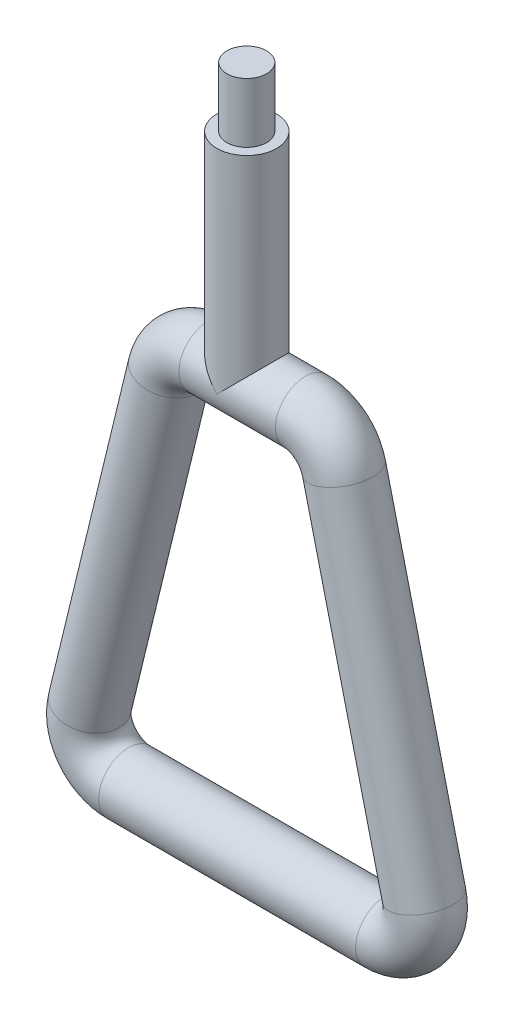
from build123d import *

# Parameters (mm, degrees)
SWEEP1_PROFILE_R         = 7.5
BOSS_EXTRUDE1_REACH      = 188.649
BOSS_EXTRUDE1_END_RADIUS = 7.5
SKETCH10_R               = 7.5
SKETCH11_R               = 7.5
SKETCH11_R_2             = 5
CUT_EXTRUDE1_DEPTH       = 15


with BuildPart() as part:
    # Sweep1: sweep along a path in Sketch1
    with BuildLine(Plane.XY) as sweep1_path:
        Line((-9.568747019, 51.5), (14.70492956, 51.5))
        ThreePointArc((14.70492956, 51.5), (20.88607003, 49.360884333), (24.422775616, 43.858700499))
        Line((24.422775616, 43.858700499), (44.568406684, -39.141299501))
        ThreePointArc((44.568406684, -39.141299501), (42.711444961, -47.68114047), (34.850560628, -51.5))
        Line((34.850560628, -51.5), (-29.714378087, -51.5))
        ThreePointArc((-29.714378087, -51.5), (-37.57526242, -47.68114047), (-39.432224142, -39.141299501))
        Line((-39.432224142, -39.141299501), (-19.286593074, 43.858700499))
        ThreePointArc((-19.286593074, 43.858700499), (-15.749887488, 49.360884333), (-9.568747019, 51.5))
    # Sweep1 profile (on start of the path) → Sweep1 (sweep)
    with BuildSketch(Plane(origin=(-9.568747019, 51.5, 0), x_dir=(0, 1, 0), z_dir=(1, 0, 0))):
        Circle(SWEEP1_PROFILE_R)
    sweep(path=sweep1_path.line)

    # Boss-Extrude1: up to this cylinder (the profile starts outside it)
    boss_extrude1_end = Plane(origin=(0, 51.5, 0), z_dir=(1, 0, 0)) * Cylinder(BOSS_EXTRUDE1_END_RADIUS, 393.298, mode=Mode.PRIVATE)
    # Sketch10 → Boss-Extrude1 (add, up to the surface)
    with BuildSketch(Plane(origin=(0, 120, 0), x_dir=(1, 0, 0), z_dir=(0, 1, 0)), mode=Mode.PRIVATE) as boss_extrude1_sk1:
        with Locations(Location((0, 0, 0), (0, 0, 270))):
            Circle(SKETCH10_R)
    boss_extrude1_tool1 = extrude(boss_extrude1_sk1.sketch, amount=-BOSS_EXTRUDE1_REACH, mode=Mode.PRIVATE) - boss_extrude1_end
    add(boss_extrude1_tool1.solids().sort_by_distance((0, 120, 0))[0])

    # Sketch11 → Cut-Extrude1 (cut)
    with BuildSketch(Plane(origin=(0, 120, 0), x_dir=(1, 0, 0), z_dir=(0, 1, 0))):
        with Locations(Location((0, 0, 0), (0, 0, 270))):
            Circle(SKETCH11_R)
        with Locations(Location((0, 0, 0), (0, 0, 270))):
            Circle(SKETCH11_R_2, mode=Mode.SUBTRACT)
    extrude(amount=-CUT_EXTRUDE1_DEPTH, mode=Mode.SUBTRACT)


solid = part.part
